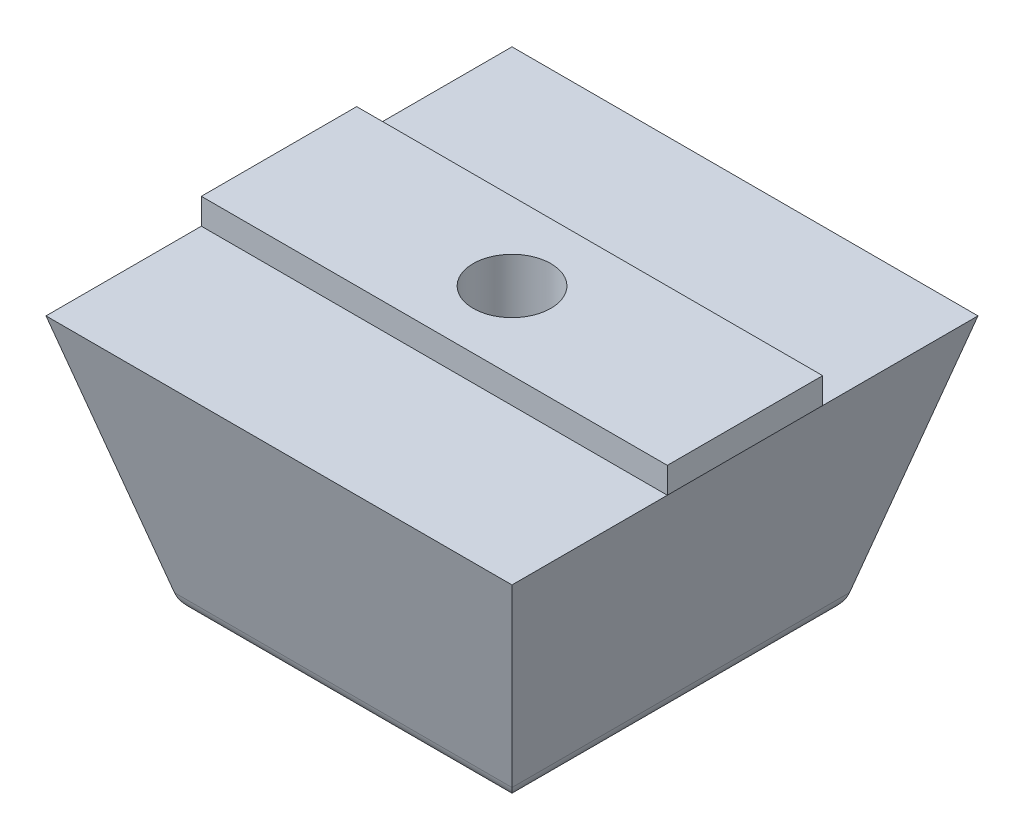
from build123d import *

# Parameters (mm, degrees)
SKETCH1_W           = 18
SKETCH1_H           = 18
BOSS_EXTRUDE1_DEPTH = 10
BOSS_EXTRUDE1_DRAFT = -15
SKETCH5_W           = 18
SKETCH5_H           = 6
BOSS_EXTRUDE3_DEPTH = 3
FILLET2_R           = 1
CUT_EXTRUDE3_REACH  = 20.193
SKETCH6_R           = 1.5
SKETCH7_R           = 3
CUT_EXTRUDE4_DEPTH  = 8
SKETCH9_W           = 20
SKETCH9_H           = 6
CUT_EXTRUDE5_DEPTH  = 2
FILLET4_R           = 1


with BuildPart() as part:
    # Sketch1 → Boss-Extrude1 (with draft: the straight prism first)
    with BuildSketch(Plane(origin=(0, 0, 0), x_dir=(1, 0, 0), z_dir=(0, 1, 0))):
        Rectangle(SKETCH1_W, SKETCH1_H)
    extrude(amount=-BOSS_EXTRUDE1_DEPTH)
    # Boss-Extrude1: the draft: its side faces are tilted about the plane it starts from
    boss_extrude1_sides = [part.faces().sort_by_distance(p)[0] for p in [
        (0, -5, 9),
        (9, -5, 0),
        (0, -5, -9),
        (-9, -5, 0),
    ]]
    draft(boss_extrude1_sides, Plane(origin=(0, 0, 0), x_dir=(1, 0, 0), z_dir=(0, 1, 0)), BOSS_EXTRUDE1_DRAFT)

    # Sketch5 → Boss-Extrude3 (add)
    with BuildSketch(Plane(origin=(0, 0, 0), x_dir=(1, 0, 0), z_dir=(0, 1, 0))):
        Rectangle(SKETCH5_W, SKETCH5_H)
    extrude(amount=BOSS_EXTRUDE3_DEPTH)

    # Fillet2
    fillet2_edges = [part.edges().sort_by_distance(p)[0] for p in [
        (0, 3, 3),
        (0, 3, -3),
    ]]
    fillet(fillet2_edges, radius=FILLET2_R)

    # Sketch6 → Cut-Extrude3 (cut, up to next)
    with BuildSketch(Plane(origin=(0, 3, 0), x_dir=(1, 0, 0), z_dir=(0, 1, 0)), mode=Mode.PRIVATE) as cut_extrude3_sk1:
        with Locations(Location((0, 0, 0), (0, 0, 270))):
            Circle(SKETCH6_R)
    cut_extrude3_tool1 = extrude(cut_extrude3_sk1.sketch, amount=-CUT_EXTRUDE3_REACH, mode=Mode.PRIVATE) & part.part
    add(cut_extrude3_tool1.solids().sort_by_distance((0, 3, 0))[0], mode=Mode.SUBTRACT)

    # Sketch7 → Cut-Extrude4 (cut)
    with BuildSketch(Plane.XZ.offset(10)):
        with Locations(Location((0, 0, 0), (0, 0, 270))):
            Circle(SKETCH7_R)
    extrude(amount=-CUT_EXTRUDE4_DEPTH, mode=Mode.SUBTRACT)

    # Sketch9 → Cut-Extrude5 (cut)
    with BuildSketch(Plane(origin=(0, 3, 0), x_dir=(1, 0, 0), z_dir=(0, 1, 0))):
        Rectangle(SKETCH9_W, SKETCH9_H)
    extrude(amount=-CUT_EXTRUDE5_DEPTH, mode=Mode.SUBTRACT)

    # Fillet4
    fillet4_edges = [part.edges().sort_by_distance(p)[0] for p in [
        (-6.320508076, -10, 0),
        (0, -10, 6.320508076),
        (6.320508076, -10, 0),
        (0, -10, -6.320508076),
    ]]
    fillet(fillet4_edges, radius=FILLET4_R)


solid = part.part
